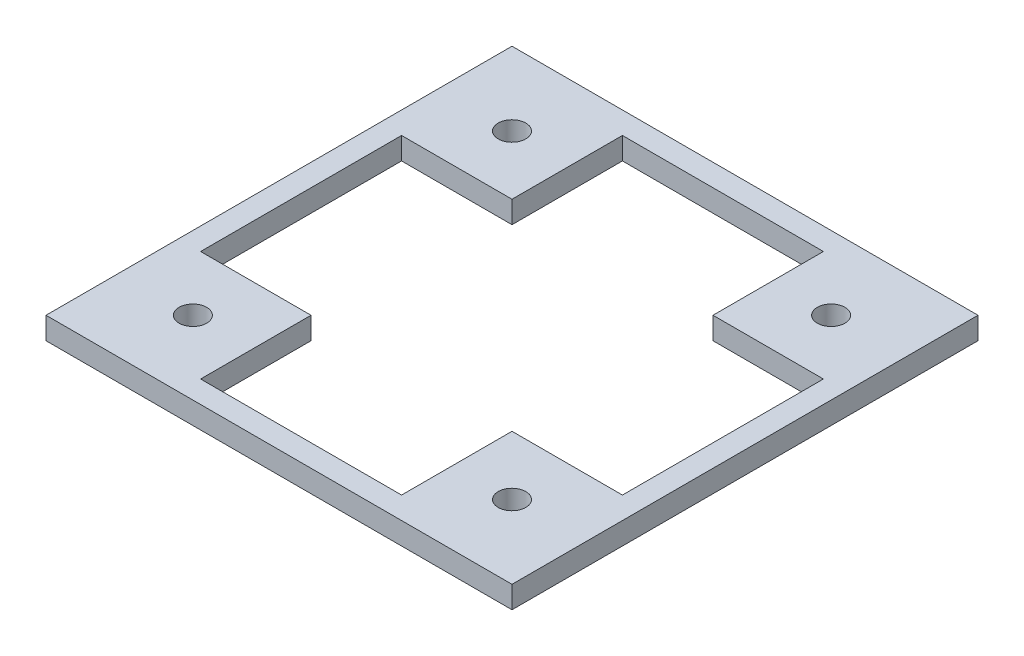
from build123d import *

# Parameters (mm, degrees)
SKETCH1_W             = 42.2
SKETCH1_H             = 42.2
SKETCH1_W_2           = 38.2
SKETCH1_H_2           = 38.2
SKETCH1_W_3           = 10
SKETCH1_H_3           = 10
BOSS_EXTRUDE1_DEPTH   = 2
M3X0_5_TAPPED_HOLE2_D = 2.5


with BuildPart() as part:
    # Sketch1 → Boss-Extrude1 (new body)
    # profile 1 of 5: a face of its own
    with BuildSketch(Plane(origin=(0, 0, 0), x_dir=(1, 0, 0), z_dir=(0, 1, 0))):
        with Locations((-63.025626343, 33.9108558)):
            Rectangle(SKETCH1_W, SKETCH1_H)
        with Locations((-63.025626343, 33.9108558)):
            Rectangle(SKETCH1_W_2, SKETCH1_H_2, mode=Mode.SUBTRACT)
    # profile 2 of 5: a face of its own
    with BuildSketch(Plane(origin=(0, 0, 0), x_dir=(1, 0, 0), z_dir=(0, 1, 0))):
        with Locations((-77.125626343, 48.0108558)):
            Rectangle(SKETCH1_W_3, SKETCH1_H_3)
    # profile 3 of 5: a face of its own
    with BuildSketch(Plane(origin=(0, 0, 0), x_dir=(1, 0, 0), z_dir=(0, 1, 0))):
        with Locations((-48.925626343, 48.0108558)):
            Rectangle(SKETCH1_W_3, SKETCH1_H_3)
    # profile 4 of 5: a face of its own
    with BuildSketch(Plane(origin=(0, 0, 0), x_dir=(1, 0, 0), z_dir=(0, 1, 0))):
        with Locations((-48.925626343, 19.8108558)):
            Rectangle(SKETCH1_W_3, SKETCH1_H_3)
    # profile 5 of 5: a face of its own
    with BuildSketch(Plane(origin=(0, 0, 0), x_dir=(1, 0, 0), z_dir=(0, 1, 0))):
        with Locations((-77.125626343, 19.8108558)):
            Rectangle(SKETCH1_W_3, SKETCH1_H_3)
    extrude(amount=BOSS_EXTRUDE1_DEPTH)

    # M3x0.5 Tapped Hole2 (through all)
    with Locations(Plane(origin=(0, 2, 0), x_dir=(1, 0, 0), z_dir=(0, 1, 0))):
        with Locations((-77.475626343, 48.3608558), (-48.575626343, 48.3608558), (-48.575626343, 19.4608558), (-77.475626343, 19.4608558)):
            Hole(M3X0_5_TAPPED_HOLE2_D / 2)


solid = part.part
